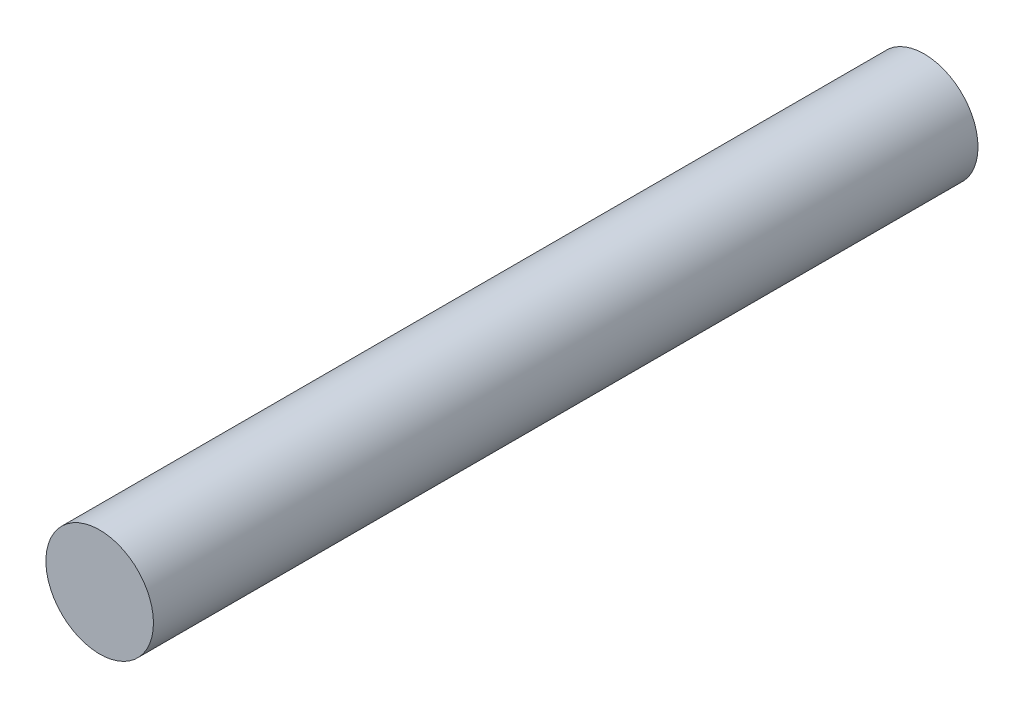
from build123d import *

# Parameters (mm, degrees)
SKETCH1_R           = 1.5
BOSS_EXTRUDE1_DEPTH = 23


with BuildPart() as part:
    # Sketch1 → Boss-Extrude1 (new body)
    with BuildSketch(Plane.XY):
        with Locations((-46, 0)):
            Circle(SKETCH1_R)
    extrude(amount=-BOSS_EXTRUDE1_DEPTH)


solid = part.part
